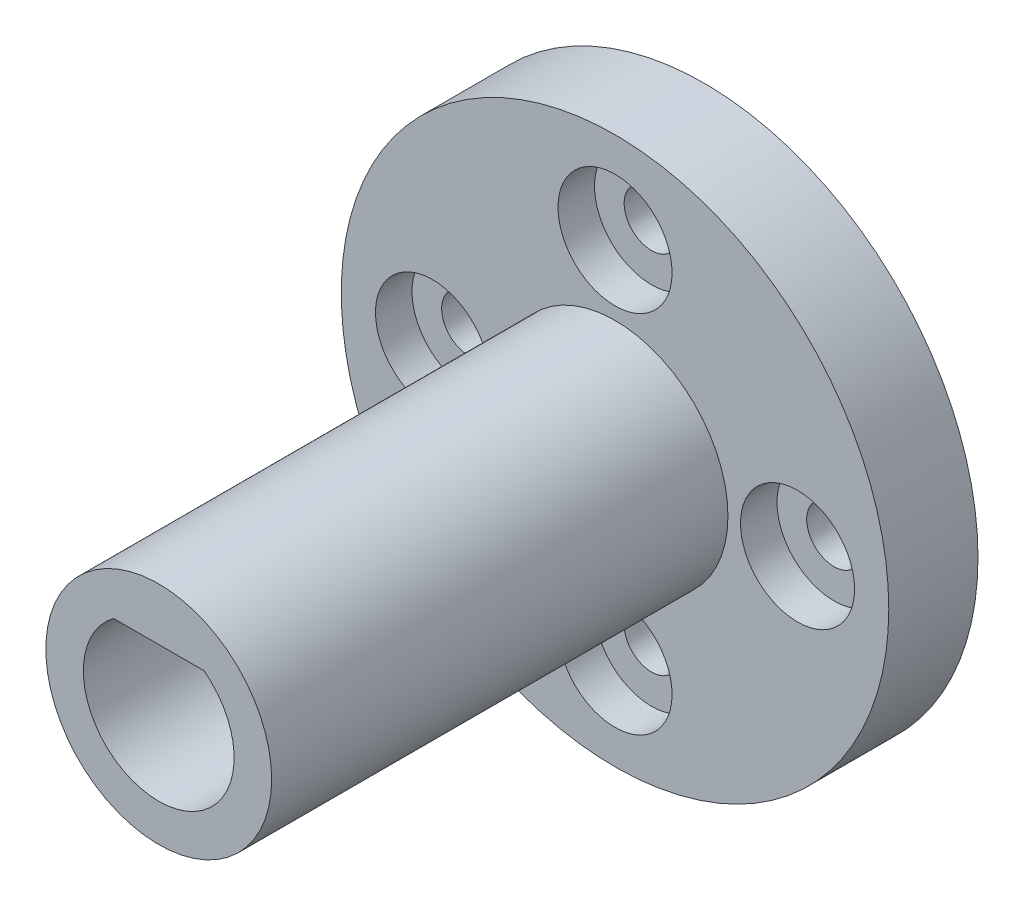
from build123d import *

# Parameters (mm, degrees)
ESQUISSE1_R                                        = 12
BOSS_EXTRU_1_DEPTH                                 = 3.91
ESQUISSE6_R                                        = 4
ENL_V_MAT_EXTRU_2_DEPTH                            = 1.91
ESQUISSE7_R                                        = 4.95
BOSS_EXTRU_2_DEPTH                                 = 20
CHAMBRAGE_POUR_VIS_T_TE_RONDE_BOMB_E_M_D           = 2.4
CHAMBRAGE_POUR_VIS_T_TE_RONDE_BOMB_E_M_CBORE_D     = 5
CHAMBRAGE_POUR_VIS_T_TE_RONDE_BOMB_E_M_CBORE_DEPTH = 1.6
R_P_TITION_CIRCULAIRE2_COUNT                       = 4


with BuildPart() as part:
    # Esquisse1 → Boss.-Extru.1 (new body)
    with BuildSketch(Plane.XY):
        Circle(ESQUISSE1_R)
    extrude(amount=BOSS_EXTRU_1_DEPTH)

    # Esquisse6 → Enlèv. mat.-Extru.2 (cut)
    with BuildSketch(Plane(origin=(0, 0, 0), x_dir=(-1, 0, 0), z_dir=(0, 0, -1))):
        Circle(ESQUISSE6_R)
    extrude(amount=-ENL_V_MAT_EXTRU_2_DEPTH, mode=Mode.SUBTRACT)

    # Esquisse7 → Boss.-Extru.2 (add)
    with BuildSketch(Plane.XY.offset(3.91)):
        Circle(ESQUISSE7_R)
        with BuildLine():
            Line((1.981665966, 2.645), (-1.981665966, 2.645))
            ThreePointArc((-1.981665966, 2.645), (0, -3.305), (1.981665966, 2.645))
        make_face(mode=Mode.SUBTRACT)
    extrude(amount=BOSS_EXTRU_2_DEPTH)

    # Chambrage pour vis à tête ronde bombée M21 (through all)
    with Locations(Plane.XY.offset(3.91)):
        with Locations((0, 8)):
            chambrage_pour_vis_t_te_ronde_bomb_e_m = CounterBoreHole(CHAMBRAGE_POUR_VIS_T_TE_RONDE_BOMB_E_M_D / 2, CHAMBRAGE_POUR_VIS_T_TE_RONDE_BOMB_E_M_CBORE_D / 2, CHAMBRAGE_POUR_VIS_T_TE_RONDE_BOMB_E_M_CBORE_DEPTH)

    # Répétition circulaire2: Chambrage pour vis à tête ronde bombée M21 ×4 about axis
    r_p_tition_circulaire2_axis = Axis((0, 0, 0), (0, 0, 1))
    for i in range(1, R_P_TITION_CIRCULAIRE2_COUNT):
        add(chambrage_pour_vis_t_te_ronde_bomb_e_m.rotate(r_p_tition_circulaire2_axis, i * 360 / R_P_TITION_CIRCULAIRE2_COUNT), mode=Mode.SUBTRACT)


solid = part.part
